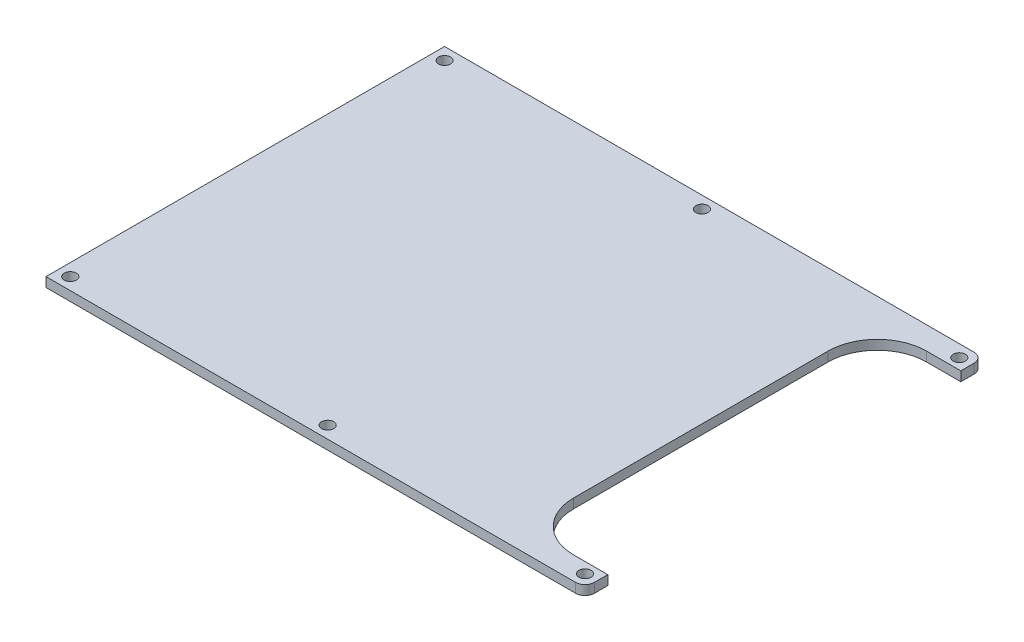
from build123d import *

# Parameters (mm, degrees)
SKETCH1_W           = 142
SKETCH1_H           = 105
BOSS_EXTRUDE1_DEPTH = 2.5
CUT_EXTRUDE1_REACH  = 90.337
SKETCH2_R           = 1.6
SKETCH2_W           = 22
SKETCH2_H           = 93
FILLET1_R           = 13
FILLET2_R           = 2.5


with BuildPart() as part:
    # Sketch1 → Boss-Extrude1 (new body)
    with BuildSketch(Plane(origin=(0, 0, 0), x_dir=(1, 0, 0), z_dir=(0, 1, 0))):
        Rectangle(SKETCH1_W, SKETCH1_H)
    extrude(amount=BOSS_EXTRUDE1_DEPTH)

    # Sketch2 → Cut-Extrude1 (cut, up to next)
    with BuildSketch(Plane(origin=(0, 2.5, 0), x_dir=(1, 0, 0), z_dir=(0, 1, 0)), mode=Mode.PRIVATE) as cut_extrude1_sk1:
        with Locations(Location((-67.8, 49.3, 0), (0, 0, 270))):
            Circle(SKETCH2_R)
    cut_extrude1_tool1 = extrude(cut_extrude1_sk1.sketch, amount=-CUT_EXTRUDE1_REACH, mode=Mode.PRIVATE) & part.part
    # Sketch2 → Cut-Extrude1 (cut, up to next)
    with BuildSketch(Plane(origin=(0, 2.5, 0), x_dir=(1, 0, 0), z_dir=(0, 1, 0)), mode=Mode.PRIVATE) as cut_extrude1_sk2:
        with Locations(Location((0, 49.3, 0), (0, 0, 270))):
            Circle(SKETCH2_R)
    cut_extrude1_tool2 = extrude(cut_extrude1_sk2.sketch, amount=-CUT_EXTRUDE1_REACH, mode=Mode.PRIVATE) & part.part
    # Sketch2 → Cut-Extrude1 (cut, up to next)
    with BuildSketch(Plane(origin=(0, 2.5, 0), x_dir=(1, 0, 0), z_dir=(0, 1, 0)), mode=Mode.PRIVATE) as cut_extrude1_sk3:
        with Locations(Location((0, -49.3, 0), (0, 0, 270))):
            Circle(SKETCH2_R)
    cut_extrude1_tool3 = extrude(cut_extrude1_sk3.sketch, amount=-CUT_EXTRUDE1_REACH, mode=Mode.PRIVATE) & part.part
    # Sketch2 → Cut-Extrude1 (cut, up to next)
    with BuildSketch(Plane(origin=(0, 2.5, 0), x_dir=(1, 0, 0), z_dir=(0, 1, 0)), mode=Mode.PRIVATE) as cut_extrude1_sk4:
        with Locations(Location((-67.8, -49.3, 0), (0, 0, 270))):
            Circle(SKETCH2_R)
    cut_extrude1_tool4 = extrude(cut_extrude1_sk4.sketch, amount=-CUT_EXTRUDE1_REACH, mode=Mode.PRIVATE) & part.part
    # Sketch2 → Cut-Extrude1 (cut, up to next)
    with BuildSketch(Plane(origin=(0, 2.5, 0), x_dir=(1, 0, 0), z_dir=(0, 1, 0)), mode=Mode.PRIVATE) as cut_extrude1_sk5:
        with Locations(Location((67.8, 49.3, 0), (0, 0, 270))):
            Circle(SKETCH2_R)
    cut_extrude1_tool5 = extrude(cut_extrude1_sk5.sketch, amount=-CUT_EXTRUDE1_REACH, mode=Mode.PRIVATE) & part.part
    # Sketch2 → Cut-Extrude1 (cut, up to next)
    with BuildSketch(Plane(origin=(0, 2.5, 0), x_dir=(1, 0, 0), z_dir=(0, 1, 0)), mode=Mode.PRIVATE) as cut_extrude1_sk6:
        with Locations(Location((67.8, -49.3, 0), (0, 0, 270))):
            Circle(SKETCH2_R)
    cut_extrude1_tool6 = extrude(cut_extrude1_sk6.sketch, amount=-CUT_EXTRUDE1_REACH, mode=Mode.PRIVATE) & part.part
    # Sketch2 → Cut-Extrude1 (cut, up to next)
    with BuildSketch(Plane(origin=(0, 2.5, 0), x_dir=(1, 0, 0), z_dir=(0, 1, 0)), mode=Mode.PRIVATE) as cut_extrude1_sk7:
        with Locations((60, 0)):
            Rectangle(SKETCH2_W, SKETCH2_H)
    cut_extrude1_tool7 = extrude(cut_extrude1_sk7.sketch, amount=-CUT_EXTRUDE1_REACH, mode=Mode.PRIVATE) & part.part
    add(cut_extrude1_tool1.solids().sort_by_distance((-67.8, 2.5, -49.3))[0], mode=Mode.SUBTRACT)
    add(cut_extrude1_tool2.solids().sort_by_distance((0, 2.5, -49.3))[0], mode=Mode.SUBTRACT)
    add(cut_extrude1_tool3.solids().sort_by_distance((0, 2.5, 49.3))[0], mode=Mode.SUBTRACT)
    add(cut_extrude1_tool4.solids().sort_by_distance((-67.8, 2.5, 49.3))[0], mode=Mode.SUBTRACT)
    add(cut_extrude1_tool5.solids().sort_by_distance((67.8, 2.5, -49.3))[0], mode=Mode.SUBTRACT)
    add(cut_extrude1_tool6.solids().sort_by_distance((67.8, 2.5, 49.3))[0], mode=Mode.SUBTRACT)
    add(cut_extrude1_tool7.solids().sort_by_distance((60, 2.5, 0))[0], mode=Mode.SUBTRACT)

    # Fillet1
    fillet1_edges = [part.edges().sort_by_distance(p)[0] for p in [
        (49, 1.25, 46.5),
        (49, 1.25, -46.5),
    ]]
    fillet(fillet1_edges, radius=FILLET1_R)

    # Fillet2
    fillet2_edges = [part.edges().sort_by_distance(p)[0] for p in [
        (71, 1.25, 52.5),
        (71, 1.25, -52.5),
    ]]
    fillet(fillet2_edges, radius=FILLET2_R)


solid = part.part
